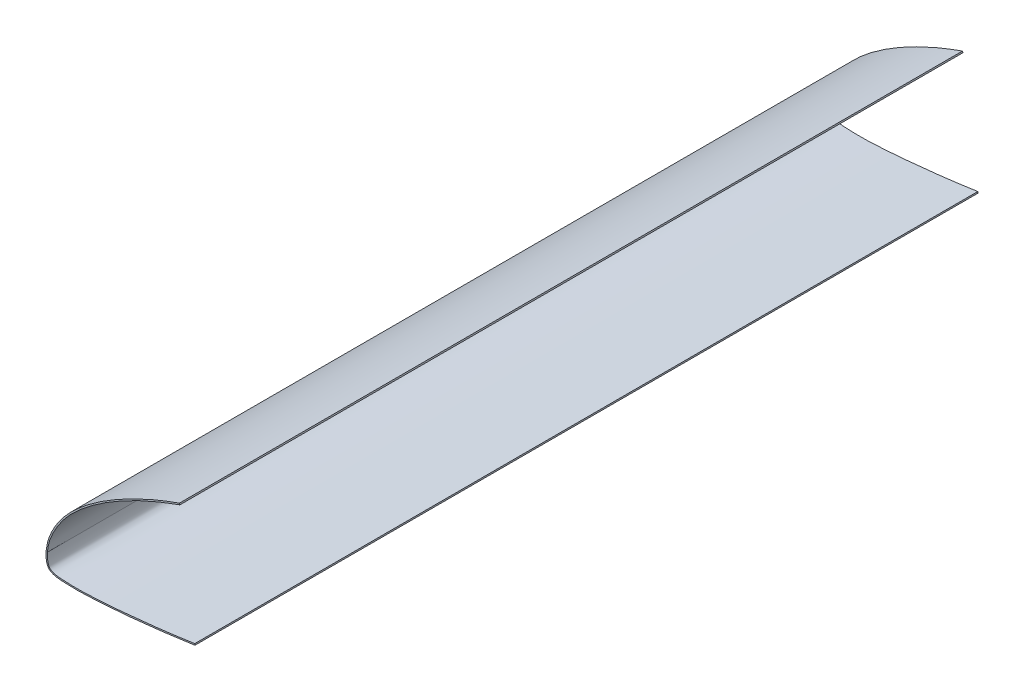
from build123d import *

# Parameters (mm, degrees)
BOSS_EXTRUDE1_DEPTH = 457.2


with BuildPart() as part:
    # Sketch1 → Boss-Extrude1 (new body)
    with BuildSketch(Plane(origin=(0, 0, 319.681194078), x_dir=(-1, 0, 0), z_dir=(0, 0, -1))):
        with BuildLine():
            Line((-184.807585519, 344.222837463), (-184.92757135, 343.438208593))
            add(Edge.make_bspline(
                [(-184.92757135, 343.438208593), (-181.040933485, 342.843862028), (-173.253081526, 341.752110108), (-161.542083063, 340.325860568), (-151.77018341, 339.26490288), (-143.941912164, 338.511632739), (-138.065867745, 338.005476288), (-132.183559819, 337.569286594), (-126.298268743, 337.208958243), (-120.402425753, 336.915226123), (-115.494718924, 336.845343616), (-111.546807905, 336.944791731), (-108.614760213, 337.05916287), (-105.668551651, 337.180770053), (-103.23771824, 337.571697676), (-101.313088235, 338.281485887), (-100.017793574, 339.042202664), (-99.056914162, 340.136986868), (-98.477375887, 341.521164247), (-98.154490298, 343.021943609), (-97.942735647, 345.001594157), (-97.947176665, 346.45847794), (-97.950180416, 347.436261822)],
                knots=[8.7815e-05, 8.7815e-05, 8.7815e-05, 8.7815e-05, 0.019258644, 0.038429474, 0.057600304, 0.067185719, 0.076771133, 0.086356548, 0.095941963, 0.105527378, 0.115112793, 0.1199055, 0.124698208, 0.129490915, 0.134283622, 0.136679976, 0.13907633, 0.141472684, 0.143869037, 0.146265391, 0.148661745, 0.153454452, 0.153454452, 0.153454452, 0.153454452], degree=3))
            add(Edge.make_bspline(
                [(-97.950180416, 347.436261822), (-98.100581128, 348.520263004), (-98.397174316, 350.695359269), (-99.142597548, 353.875262447), (-100.306877132, 356.959325428), (-102.164200072, 360.929575002), (-104.94392028, 365.63919815), (-108.922377523, 370.871204814), (-113.428657002, 375.649260439), (-119.947374772, 381.480108266), (-128.728393565, 388.017974072), (-139.907274969, 394.886145622), (-155.440035218, 402.936502443), (-167.611094993, 407.87925406), (-175.853570149, 410.776885929)],
                knots=[0.836169969, 0.836169969, 0.836169969, 0.836169969, 0.841287052, 0.846404134, 0.851521216, 0.856638298, 0.866872462, 0.877106626, 0.887340791, 0.897574955, 0.918043283, 0.938511612, 0.95897994, 0.999916597, 0.999916597, 0.999916597, 0.999916597], degree=3))
            Line((-175.853570149, 410.776885929), (-176.116818731, 410.028060685))
            add(Edge.make_bspline(
                [(-98.743762825, 347.380261796), (-98.892397356, 348.45190969), (-99.190681161, 350.619119091), (-99.91735457, 353.684720681), (-101.055954059, 356.6901874), (-102.887136936, 360.595560384), (-105.627816001, 365.230037823), (-109.553958473, 370.386106109), (-114.007117785, 375.102966209), (-120.469041894, 380.87922721), (-129.194692793, 387.37366792), (-140.314460751, 394.203435551), (-155.776686671, 402.216013166), (-167.905841345, 407.141501818), (-176.116818731, 410.028060685)],
                knots=[0.836254434, 0.836254434, 0.836254434, 0.836254434, 0.841368877, 0.846483319, 0.851597762, 0.856712204, 0.86694109, 0.877169975, 0.88739886, 0.897627745, 0.918085516, 0.938543286, 0.959001057, 0.999916597, 0.999916597, 0.999916597, 0.999916597], degree=3))
            add(Edge.make_bspline(
                [(-184.807585519, 344.222837463), (-180.928818915, 343.629694575), (-173.158073701, 342.540277813), (-161.464836405, 341.116003816), (-151.707572955, 340.056460006), (-143.893347991, 339.304277984), (-138.029255706, 338.79888589), (-132.16103886, 338.363344035), (-126.286837549, 338.00337161), (-120.410585645, 337.710023245), (-114.563289728, 337.625021098), (-109.655593145, 337.810865159), (-105.771779498, 337.97060001), (-103.011322642, 338.41100989), (-100.800979937, 339.371721701), (-99.776949816, 340.510728532), (-99.256392073, 341.698889754), (-98.94826176, 343.092608986), (-98.791779311, 344.508094865), (-98.740120027, 345.927625566), (-98.742298005, 346.898054724), (-98.743762825, 347.380261796)],
                knots=[8.7815e-05, 8.7815e-05, 8.7815e-05, 8.7815e-05, 0.019247558, 0.0384073, 0.057567043, 0.067146914, 0.076726786, 0.086306657, 0.095886528, 0.1054664, 0.115046271, 0.124626142, 0.129416078, 0.134206014, 0.138995949, 0.141390917, 0.143785885, 0.146180853, 0.148575821, 0.150970788, 0.153365756, 0.153365756, 0.153365756, 0.153365756], degree=3))
        make_face()
    extrude(amount=-BOSS_EXTRUDE1_DEPTH)


solid = part.part
